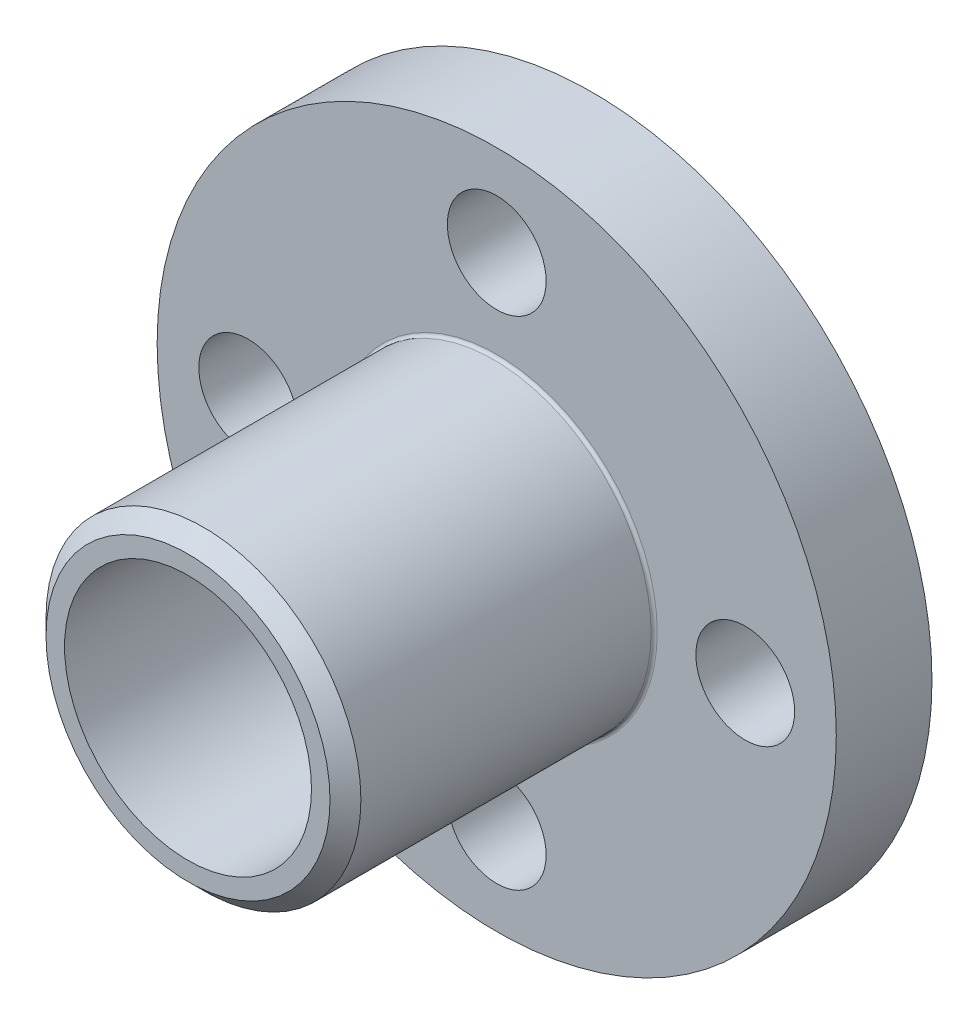
from build123d import *

# Parameters (mm, degrees)
SKETCH1_R                = 11
SKETCH1_R_2              = 5.075
BOSS_EXTRUDE1_DEPTH      = 3.1
BOSS_EXTRUDE2_DEPTH      = 10
BOSS_EXTRUDE2_DEPTH_BACK = 3.1
SKETCH2_R                = 5.1
SKETCH2_R_2              = 4
CHAMFER1_SIZE            = 0.5
FILLET1_R                = 0.1
SKETCH3_R                = 1.6
CUT_EXTRUDE1_DEPTH       = 10


with BuildPart() as part:
    # Sketch1 → Boss-Extrude1 (new body)
    with BuildSketch(Plane.XY):
        with Locations(Location((0, 0, 0), (0, 0, 180))):
            Circle(SKETCH1_R)
        with Locations(Location((0, 0, 0), (0, 0, 180))):
            Circle(SKETCH1_R_2, mode=Mode.SUBTRACT)
    extrude(amount=BOSS_EXTRUDE1_DEPTH)

    # Sketch2 → Boss-Extrude2 (add, two sides: drawn at the far end of the back side and taken through both)
    with BuildSketch(Plane.XY.offset(3.1).offset(-BOSS_EXTRUDE2_DEPTH_BACK)):
        Circle(SKETCH2_R)
        Circle(SKETCH2_R_2, mode=Mode.SUBTRACT)
    extrude(amount=BOSS_EXTRUDE2_DEPTH + BOSS_EXTRUDE2_DEPTH_BACK)

    # Chamfer1
    chamfer1_edges = [part.edges().sort_by_distance(p)[0] for p in [
        (-5.1, 0, 13.1),
    ]]
    chamfer(chamfer1_edges, length=CHAMFER1_SIZE)

    # Fillet1
    fillet1_edges = [part.edges().sort_by_distance(p)[0] for p in [
        (-5.1, 0, 3.1),
    ]]
    fillet(fillet1_edges, radius=FILLET1_R)

    # Sketch3 → Cut-Extrude1 (cut)
    with BuildSketch(Plane.XY.offset(3.1)):
        with Locations((0, 8.05)):
            Circle(SKETCH3_R)
        with Locations((8.05, 0)):
            Circle(SKETCH3_R)
        with Locations((0, -8.05)):
            Circle(SKETCH3_R)
        with Locations((-8.05, 0)):
            Circle(SKETCH3_R)
    extrude(amount=-CUT_EXTRUDE1_DEPTH, mode=Mode.SUBTRACT)


solid = part.part
